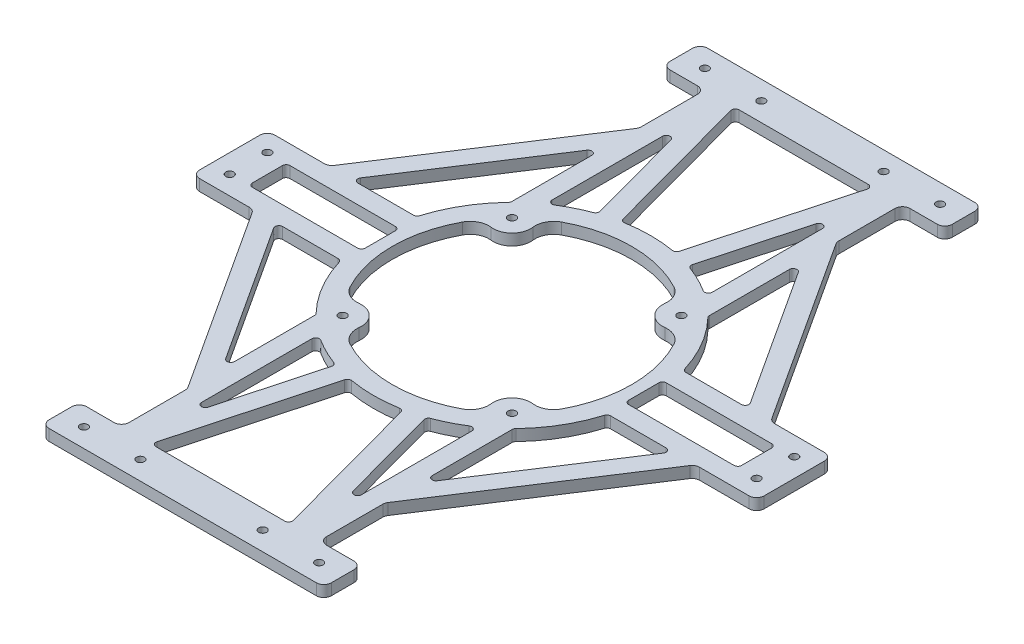
from build123d import *

# Parameters (mm, degrees)
EXTRUDE_5_DEPTH         = 6
CUT_EXTRUDE_5_DEPTH     = 231.566693171
HOLE_WIZARD_4_2_4_2_4_D = 4.2
SKETCH_23_W             = 60
SKETCH_23_H             = 20
CUT_EXTRUDE_6_DEPTH     = 10
FILLET_2_R              = 2
FILLET_3_R              = 4
HOLE_WIZARD_4_2_4_2_6_D = 4.2
FILLET_4_R              = 10


with BuildPart() as part:
    # 草图19 → 凸台-拉伸5 (new body)
    with BuildSketch(Plane(origin=(0, 0, 0), x_dir=(1, 0, 0), z_dir=(0, 1, 0))):
        Polygon((-75, -175), (75, -175), (75, -155), (52.5, -155), (52.5, -120), (117.5, -20), (150, -20), (150, 20), (117.5, 20), (52.5, 120), (52.5, 155), (75, 155), (75, 175), (-75, 175), (-75, 155), (-52.5, 155), (-52.5, 120), (-117.5, 20), (-150, 20), (-150, -20), (-117.5, -20), (-52.5, -120), (-52.5, -155), (-75, -155), align=None)
    extrude(amount=EXTRUDE_5_DEPTH)

    # 草图15 → 切除-拉伸5 (cut, through all)
    with BuildSketch(Plane(origin=(0, 0, 0), x_dir=(1, 0, 0), z_dir=(0, 1, 0))):
        with BuildLine():
            ThreePointArc((-51.493654189, 37.3952347), (-63.639610307, 0), (-51.493654189, -37.3952347))
            ThreePointArc((-51.493654189, -37.3952347), (-37.928932188, -37.928932188), (-37.3952347, -51.493654189))
            ThreePointArc((-37.3952347, -51.493654189), (0, -63.639610307), (37.3952347, -51.493654189))
            ThreePointArc((37.3952347, -51.493654189), (37.928932188, -37.928932188), (51.493654189, -37.3952347))
            ThreePointArc((51.493654189, -37.3952347), (63.639610307, 0), (51.493654189, 37.3952347))
            ThreePointArc((51.493654189, 37.3952347), (37.928932188, 37.928932188), (37.3952347, 51.493654189))
            ThreePointArc((37.3952347, 51.493654189), (0, 63.639610307), (-37.3952347, 51.493654189))
            ThreePointArc((-37.3952347, 51.493654189), (-37.928932188, 37.928932188), (-51.493654189, 37.3952347))
        make_face()
    extrude(amount=CUT_EXTRUDE_5_DEPTH, mode=Mode.SUBTRACT)

    # Ø4.2 (4.2) 直径孔4 (through all)
    with Locations(Plane(origin=(-62.5, 6, 165), x_dir=(0, 0, 1), z_dir=(0, 1, 0))):
        with Locations((0, 0), (0, 30), (0, 95), (0, 125), (-175, 202.5), (-155, 202.5), (-175, -77.5), (-155, -77.5), (-330, 0), (-330, 30), (-330, 95), (-330, 125)):
            Hole(HOLE_WIZARD_4_2_4_2_4_D / 2)

    # 草图23 → 切除-拉伸6 (cut)
    with BuildSketch(Plane(origin=(0, 6, 0), x_dir=(1, 0, 0), z_dir=(0, 1, 0))):
        with BuildLine():
            Line((36.89051777, -155), (-36.89051777, -155))
            Line((-36.89051777, -155), (-14.420019729, -72.213954587))
            ThreePointArc((-14.420019729, -72.213954587), (0, -73.639610307), (14.420019729, -72.213954587))
            Line((14.420019729, -72.213954587), (36.89051777, -155))
        make_face()
        with BuildLine():
            Line((24.070832475, -69.594448271), (42.5, -137.491381257))
            Line((42.5, -137.491381257), (42.5, -60.137693721))
            ThreePointArc((42.5, -60.137693721), (33.619584854, -65.517293293), (24.070832475, -69.594448271))
        make_face()
        with BuildLine():
            Line((42.5, 137.491381257), (42.5, 60.137693721))
            ThreePointArc((42.5, 60.137693721), (33.619584854, 65.517293293), (24.070832475, 69.594448271))
            Line((24.070832475, 69.594448271), (42.5, 137.491381257))
        make_face()
        with BuildLine():
            Line((-42.5, 60.137693721), (-42.5, 137.491381257))
            Line((-42.5, 137.491381257), (-24.070832475, 69.594448271))
            ThreePointArc((-24.070832475, 69.594448271), (-33.619584854, 65.517293293), (-42.5, 60.137693721))
        make_face()
        with BuildLine():
            Line((-105.573139558, -20), (-52.5, -101.650983936))
            Line((-52.5, -101.650983936), (-52.5, -51.638572851))
            ThreePointArc((-52.5, -51.638572851), (-63.681955469, -36.97838225), (-70.871660106, -20))
            Line((-70.871660106, -20), (-105.573139558, -20))
        make_face()
        with BuildLine():
            Line((-42.5, -137.491381257), (-24.070832475, -69.594448271))
            ThreePointArc((-24.070832475, -69.594448271), (-33.619584854, -65.517293293), (-42.5, -60.137693721))
            Line((-42.5, -60.137693721), (-42.5, -137.491381257))
        make_face()
        with BuildLine():
            Line((52.5, -101.650983936), (105.573139558, -20))
            Line((105.573139558, -20), (70.871660106, -20))
            ThreePointArc((70.871660106, -20), (63.681955469, -36.97838225), (52.5, -51.638572851))
            Line((52.5, -51.638572851), (52.5, -101.650983936))
        make_face()
        with BuildLine():
            Line((-36.89051777, 155), (-14.420019729, 72.213954587))
            ThreePointArc((-14.420019729, 72.213954587), (0, 73.639610307), (14.420019729, 72.213954587))
            Line((14.420019729, 72.213954587), (36.89051777, 155))
            Line((36.89051777, 155), (-36.89051777, 155))
        make_face()
        with BuildLine():
            Line((-52.5, 101.650983936), (-105.573139558, 20))
            Line((-105.573139558, 20), (-70.871660106, 20))
            ThreePointArc((-70.871660106, 20), (-63.681955469, 36.97838225), (-52.5, 51.638572851))
            Line((-52.5, 51.638572851), (-52.5, 101.650983936))
        make_face()
        with BuildLine():
            Line((105.573139558, 20), (52.5, 101.650983936))
            Line((52.5, 101.650983936), (52.5, 51.638572851))
            ThreePointArc((52.5, 51.638572851), (63.681955469, 36.97838225), (70.871660106, 20))
            Line((70.871660106, 20), (105.573139558, 20))
        make_face()
        with Locations((-100, 0)):
            Rectangle(SKETCH_23_W, SKETCH_23_H)
        with Locations((100, 0)):
            Rectangle(SKETCH_23_W, SKETCH_23_H)
    extrude(amount=-CUT_EXTRUDE_6_DEPTH, mode=Mode.SUBTRACT)

    # 圆角2
    fillet_2_edges = [part.edges().sort_by_distance(p)[0] for p in [
        (42.5, 3, -60.137693721),
        (24.070832475, 3, -69.594448271),
        (42.5, 3, -137.491381257),
        (-24.070832475, 3, -69.594448271),
        (-42.5, 3, -60.137693721),
        (-42.5, 3, -137.491381257),
        (-130, 3, 10),
        (-130, 3, -10),
        (-70, 3, -10),
        (-70, 3, 10),
        (24.070832475, 3, 69.594448271),
        (42.5, 3, 60.137693721),
        (42.5, 3, 137.491381257),
        (-42.5, 3, 60.137693721),
        (-24.070832475, 3, 69.594448271),
        (-42.5, 3, 137.491381257),
        (52.5, 3, 51.638572851),
        (70.871660106, 3, 20),
        (105.573139558, 3, 20),
        (52.5, 3, 101.650983936),
        (70.871660106, 3, -20),
        (52.5, 3, -51.638572851),
        (52.5, 3, -101.650983936),
        (105.573139558, 3, -20),
        (-52.5, 3, -51.638572851),
        (-70.871660106, 3, -20),
        (-105.573139558, 3, -20),
        (-52.5, 3, -101.650983936),
        (70, 3, -10),
        (130, 3, -10),
        (130, 3, 10),
        (70, 3, 10),
        (14.420019729, 3, 72.213954587),
        (36.89051777, 3, 155),
        (-36.89051777, 3, 155),
        (-14.420019729, 3, 72.213954587),
        (-36.89051777, 3, -155),
        (36.89051777, 3, -155),
        (14.420019729, 3, -72.213954587),
        (-14.420019729, 3, -72.213954587),
        (-70.871660106, 3, 20),
        (-52.5, 3, 51.638572851),
        (-52.5, 3, 101.650983936),
        (-105.573139558, 3, 20),
    ]]
    fillet(fillet_2_edges, radius=FILLET_2_R)

    # 圆角3
    fillet_3_edges = [part.edges().sort_by_distance(p)[0] for p in [
        (-75, 3, 155),
        (-52.5, 3, 155),
        (-52.5, 3, 120),
        (-117.5, 3, 20),
        (-150, 3, 20),
        (-150, 3, -20),
        (-117.5, 3, -20),
        (-52.5, 3, -120),
        (-52.5, 3, -155),
        (-75, 3, -155),
        (-75, 3, -175),
        (75, 3, -175),
        (75, 3, -155),
        (52.5, 3, -155),
        (52.5, 3, -120),
        (117.5, 3, -20),
        (150, 3, -20),
        (150, 3, 20),
        (117.5, 3, 20),
        (52.5, 3, 120),
        (52.5, 3, 155),
        (75, 3, 155),
        (75, 3, 175),
        (-75, 3, 175),
    ]]
    fillet(fillet_3_edges, radius=FILLET_3_R)

    # Ø4.2 (4.2) 直径孔6 (through all)
    with Locations(Plane(origin=(-45, 6, -45), x_dir=(0, 0, 1), z_dir=(0, 1, 0))):
        with Locations((0, 0), (90, 0), (90, 90), (0, 90)):
            Hole(HOLE_WIZARD_4_2_4_2_6_D / 2)

    # 圆角4
    fillet_4_edges = [part.edges().sort_by_distance(p)[0] for p in [
        (-51.493654189, 3, 37.3952347),
        (-37.3952347, 3, 51.493654189),
        (37.3952347, 3, 51.493654189),
        (51.493654189, 3, 37.3952347),
        (51.493654189, 3, -37.3952347),
        (37.3952347, 3, -51.493654189),
        (-37.3952347, 3, -51.493654189),
        (-51.493654189, 3, -37.3952347),
    ]]
    fillet(fillet_4_edges, radius=FILLET_4_R)


solid = part.part
